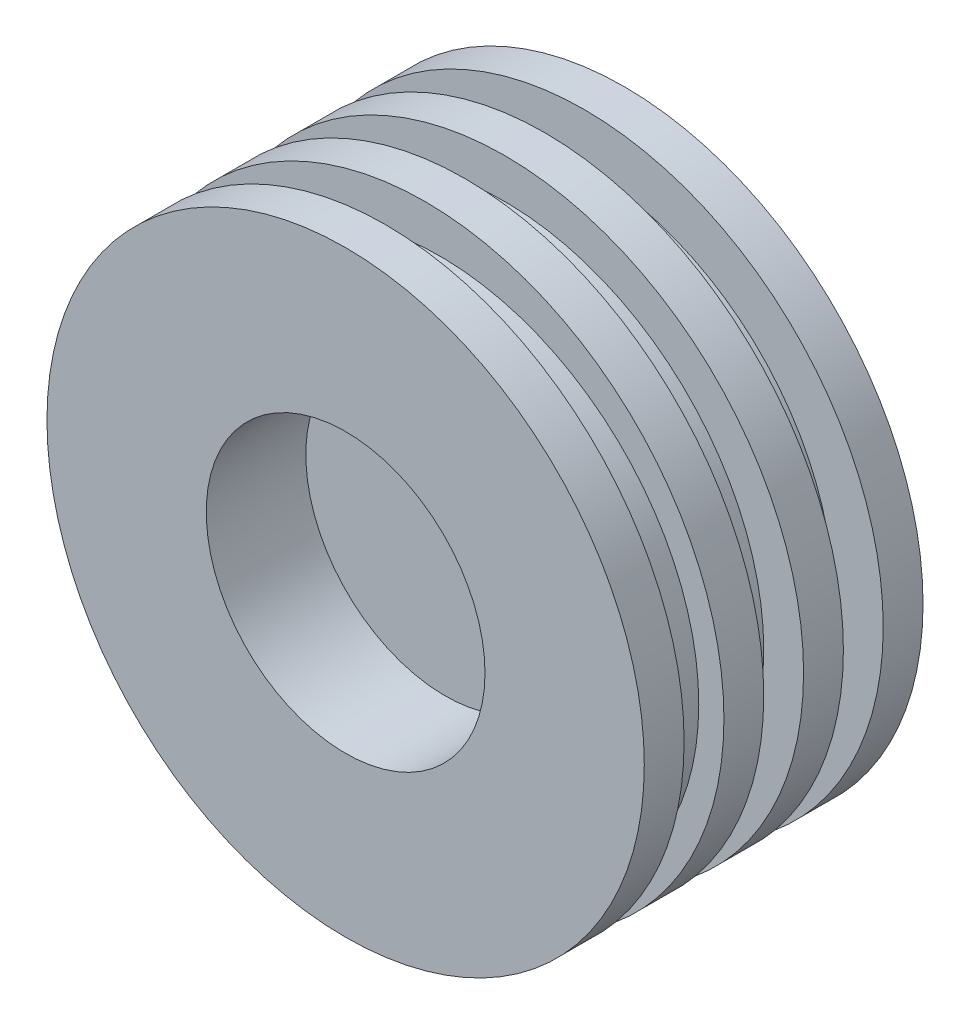
from build123d import *

# Parameters (mm, degrees)
SKETCH_1_R          = 15
EXTRUDE_1_DEPTH     = 2
SKETCH_3_R          = 12.5
EXTRUDE_2_DEPTH     = 2
SKETCH_4_R          = 15
EXTRUDE_3_DEPTH     = 2
SKETCH_5_R          = 13
EXTRUDE_4_DEPTH     = 2
SKETCH_6_R          = 15
EXTRUDE_5_DEPTH     = 2
SKETCH_7_R          = 13
EXTRUDE_6_DEPTH     = 2
SKETCH_8_R          = 15
EXTRUDE_7_DEPTH     = 2
SKETCH_9_R          = 7
CUT_EXTRUDE_1_DEPTH = 5


with BuildPart() as part:
    # 草图1 → 凸台-拉伸1 (new body)
    with BuildSketch(Plane.XY):
        Circle(SKETCH_1_R)
    extrude(amount=EXTRUDE_1_DEPTH)

    # 草图3 → 凸台-拉伸2 (add)
    with BuildSketch(Plane.XY.offset(2)):
        Circle(SKETCH_3_R)
    extrude(amount=EXTRUDE_2_DEPTH)

    # 草图4 → 凸台-拉伸3 (add)
    with BuildSketch(Plane.XY.offset(4)):
        Circle(SKETCH_4_R)
    extrude(amount=EXTRUDE_3_DEPTH)

    # 草图5 → 凸台-拉伸4 (add)
    with BuildSketch(Plane.XY.offset(6)):
        Circle(SKETCH_5_R)
    extrude(amount=EXTRUDE_4_DEPTH)

    # 草图6 → 凸台-拉伸5 (add)
    with BuildSketch(Plane.XY.offset(8)):
        Circle(SKETCH_6_R)
    extrude(amount=EXTRUDE_5_DEPTH)

    # 草图7 → 凸台-拉伸6 (add)
    with BuildSketch(Plane.XY.offset(10)):
        with Locations((0.736194689, 0)):
            Circle(SKETCH_7_R)
    extrude(amount=EXTRUDE_6_DEPTH)

    # 草图8 → 凸台-拉伸7 (add)
    with BuildSketch(Plane.XY.offset(12)):
        Circle(SKETCH_8_R)
    extrude(amount=EXTRUDE_7_DEPTH)

    # 草图9 → 切除-拉伸1 (cut)
    with BuildSketch(Plane.XY.offset(14)):
        Circle(SKETCH_9_R)
    extrude(amount=-CUT_EXTRUDE_1_DEPTH, mode=Mode.SUBTRACT)


solid = part.part
